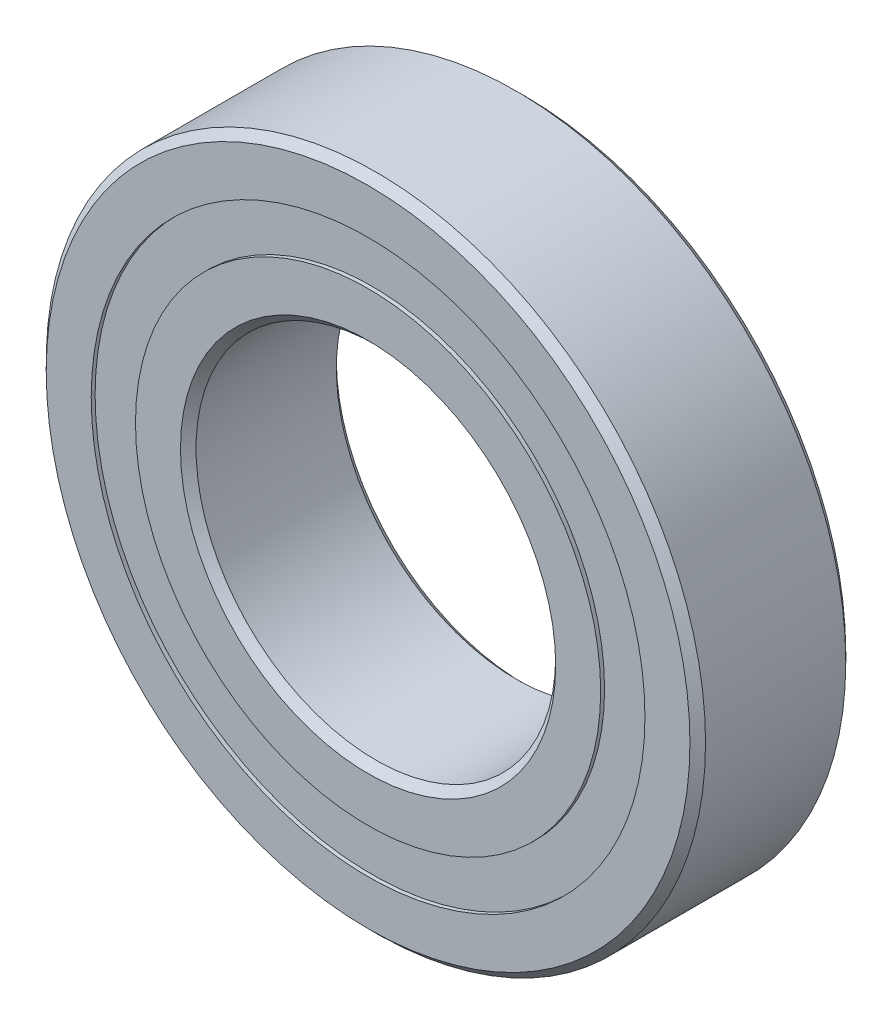
from build123d import *

# Parameters (mm, degrees)
CIRPATTERN1_COUNT = 14
SKETCH6_W         = 2.74659468
SKETCH6_H         = 3.692307692


with BuildPart() as part:
    # Sketch1 → Revolve1 (revolve)
    with BuildSketch(Plane(origin=(0, 0, 0), x_dir=(0, 0, -1), z_dir=(1, 0, 0))):
        with BuildLine():
            Line((5.85, 27.5), (-5.85, 27.5))
            Line((-5.85, 27.5), (-6.5, 26.85))
            Line((-6.5, 26.85), (-6.5, 23.096153846))
            Line((-6.5, 23.096153846), (-2.888888889, 23.096153846))
            ThreePointArc((-2.888888889, 23.096153846), (0, 24.67840532), (2.888888889, 23.096153846))
            Line((2.888888889, 23.096153846), (6.5, 23.096153846))
            Line((6.5, 23.096153846), (6.5, 26.85))
            Line((6.5, 26.85), (5.85, 27.5))
        make_face()
    revolve(axis=Axis((0, 0, 6.5), (0, 0, -1)))


with BuildPart() as body_2:
    # Sketch3 → Revolve3 (revolve)
    with BuildSketch(Plane(origin=(0, 0, 0), x_dir=(0, 0, -1), z_dir=(1, 0, 0))):
        with BuildLine():
            Line((-6.5, 19.403846154), (-2.888888889, 19.403846154))
            ThreePointArc((-2.888888889, 19.403846154), (0, 17.82159468), (2.888888889, 19.403846154))
            Line((2.888888889, 19.403846154), (6.5, 19.403846154))
            Line((6.5, 19.403846154), (6.5, 15.65))
            Line((6.5, 15.65), (5.85, 15))
            Line((5.85, 15), (-5.85, 15))
            Line((-5.85, 15), (-6.5, 15.65))
            Line((-6.5, 15.65), (-6.5, 19.403846154))
        make_face()
    revolve(axis=Axis((0, 0, 6.5), (0, 0, -1)))


with BuildPart() as body_3:
    # Sketch4 → Revolve4 (revolve)
    with BuildSketch(Plane(origin=(0, 0, 0), x_dir=(0, 0, -1), z_dir=(1, 0, 0))):
        with BuildLine():
            Line((-3.42840532, 21.25), (3.42840532, 21.25))
            ThreePointArc((3.42840532, 21.25), (0, 24.67840532), (-3.42840532, 21.25))
        make_face()
    revolve(axis=Axis((0, 21.25, 3.42840532), (0, 0, -1)))


with BuildPart() as cirpattern1_1:
    # CirPattern1: pattern copy
    add(body_3.part.rotate(Axis((0, 0, -6.5), (0, 0, 1)), 1 * 360 / CIRPATTERN1_COUNT))


with BuildPart() as cirpattern1_2:
    # CirPattern1: pattern copy
    add(body_3.part.rotate(Axis((0, 0, -6.5), (0, 0, 1)), 2 * 360 / CIRPATTERN1_COUNT))


with BuildPart() as cirpattern1_3:
    # CirPattern1: pattern copy
    add(body_3.part.rotate(Axis((0, 0, -6.5), (0, 0, 1)), 3 * 360 / CIRPATTERN1_COUNT))


with BuildPart() as cirpattern1_4:
    # CirPattern1: pattern copy
    add(body_3.part.rotate(Axis((0, 0, -6.5), (0, 0, 1)), 4 * 360 / CIRPATTERN1_COUNT))


with BuildPart() as cirpattern1_5:
    # CirPattern1: pattern copy
    add(body_3.part.rotate(Axis((0, 0, -6.5), (0, 0, 1)), 5 * 360 / CIRPATTERN1_COUNT))


with BuildPart() as cirpattern1_6:
    # CirPattern1: pattern copy
    add(body_3.part.rotate(Axis((0, 0, -6.5), (0, 0, 1)), 6 * 360 / CIRPATTERN1_COUNT))


with BuildPart() as cirpattern1_7:
    # CirPattern1: pattern copy
    add(body_3.part.rotate(Axis((0, 0, -6.5), (0, 0, 1)), 7 * 360 / CIRPATTERN1_COUNT))


with BuildPart() as cirpattern1_8:
    # CirPattern1: pattern copy
    add(body_3.part.rotate(Axis((0, 0, -6.5), (0, 0, 1)), 8 * 360 / CIRPATTERN1_COUNT))


with BuildPart() as cirpattern1_9:
    # CirPattern1: pattern copy
    add(body_3.part.rotate(Axis((0, 0, -6.5), (0, 0, 1)), 9 * 360 / CIRPATTERN1_COUNT))


with BuildPart() as cirpattern1_10:
    # CirPattern1: pattern copy
    add(body_3.part.rotate(Axis((0, 0, -6.5), (0, 0, 1)), 10 * 360 / CIRPATTERN1_COUNT))


with BuildPart() as cirpattern1_11:
    # CirPattern1: pattern copy
    add(body_3.part.rotate(Axis((0, 0, -6.5), (0, 0, 1)), 11 * 360 / CIRPATTERN1_COUNT))


with BuildPart() as cirpattern1_12:
    # CirPattern1: pattern copy
    add(body_3.part.rotate(Axis((0, 0, -6.5), (0, 0, 1)), 12 * 360 / CIRPATTERN1_COUNT))


with BuildPart() as cirpattern1_13:
    # CirPattern1: pattern copy
    add(body_3.part.rotate(Axis((0, 0, -6.5), (0, 0, 1)), 13 * 360 / CIRPATTERN1_COUNT))


with BuildPart() as body_17:
    # Sketch6 → Revolve5 (revolve)
    with BuildSketch(Plane(origin=(0, 0, 0), x_dir=(0, 0, -1), z_dir=(1, 0, 0))):
        with Locations((-4.80170266, 21.25)):
            Rectangle(SKETCH6_W, SKETCH6_H)
        with Locations((4.80170266, 21.25)):
            Rectangle(SKETCH6_W, SKETCH6_H)
    revolve(axis=Axis((0, 0, 6.5), (0, 0, -1)))


solid = Compound([part.part, body_2.part, body_3.part, cirpattern1_1.part, cirpattern1_2.part, cirpattern1_3.part, cirpattern1_4.part, cirpattern1_5.part, cirpattern1_6.part, cirpattern1_7.part, cirpattern1_8.part, cirpattern1_9.part, cirpattern1_10.part, cirpattern1_11.part, cirpattern1_12.part, cirpattern1_13.part, body_17.part])
